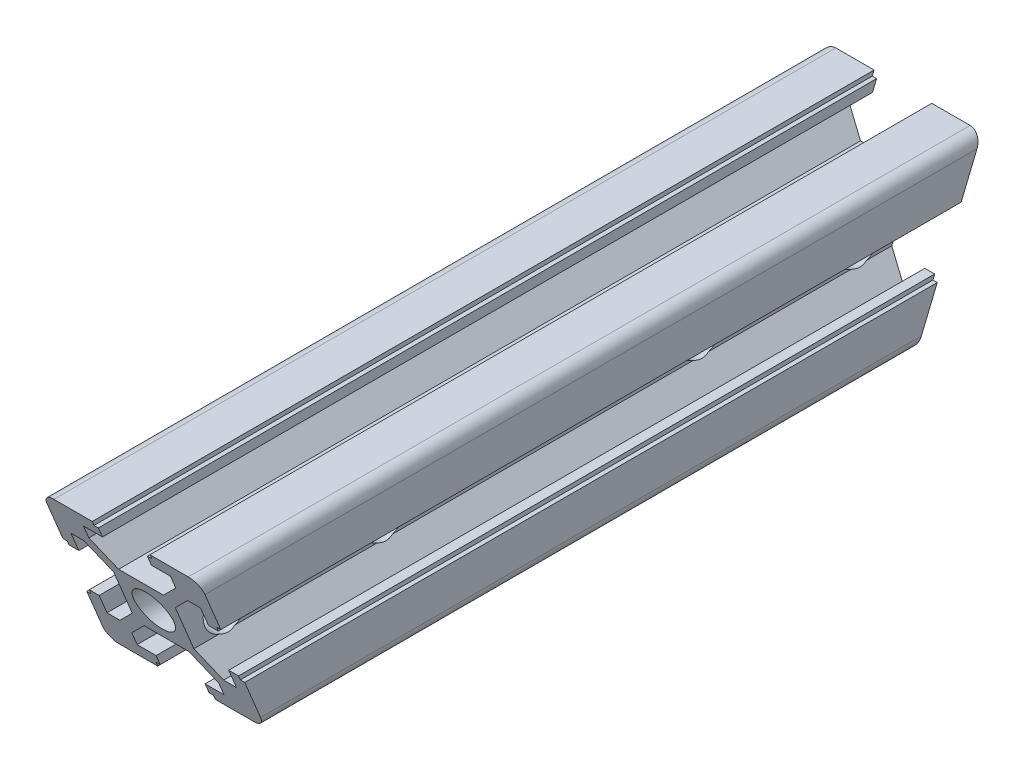
from build123d import *

# Parameters (mm, degrees)
SKETCH_2_R          = 2.55
EXTRUDE_1_DEPTH     = 98.99
SKETCH_3_R          = 3
CUT_EXTRUDE_1_DEPTH = 102.484087915
CUT_EXTRUDE_2_DEPTH = 20
SKETCH_6_R          = 3
CUT_EXTRUDE_3_DEPTH = 20


with BuildPart() as part:
    # 草图2 → 凸台-拉伸1 (new body)
    with BuildSketch(Plane.XY):
        with BuildLine():
            Line((-3.9, 2.839339828), (-6.560660172, 5.5))
            Line((-6.560660172, 5.5), (-8.2, 5.5))
            Line((-8.2, 5.5), (-8.2, 3.1))
            Line((-8.2, 3.1), (-9.45, 3.1))
            Line((-9.45, 3.1), (-9.45, 3.65))
            Line((-9.45, 3.65), (-10, 3.65))
            Line((-10, 3.65), (-10, 8.5))
            ThreePointArc((-10, 8.5), (-9.560660172, 9.560660172), (-8.5, 10))
            Line((-8.5, 10), (-3.65, 10))
            Line((-3.65, 10), (-3.65, 9.45))
            Line((-3.65, 9.45), (-3.1, 9.45))
            Line((-3.1, 9.45), (-3.1, 8.2))
            Line((-3.1, 8.2), (-5.5, 8.2))
            Line((-5.5, 8.2), (-5.5, 6.560660172))
            Line((-5.5, 6.560660172), (-2.839339828, 3.9))
            Line((-2.839339828, 3.9), (2.839339828, 3.9))
            Line((2.839339828, 3.9), (5.5, 6.560660172))
            Line((5.5, 6.560660172), (5.5, 8.2))
            Line((5.5, 8.2), (3.1, 8.2))
            Line((3.1, 8.2), (3.1, 9.45))
            Line((3.1, 9.45), (3.65, 9.45))
            Line((3.65, 9.45), (3.65, 10))
            Line((3.65, 10), (8.5, 10))
            ThreePointArc((8.5, 10), (9.560660172, 9.560660172), (10, 8.5))
            Line((10, 8.5), (10, 3.65))
            Line((10, 3.65), (9.45, 3.65))
            Line((9.45, 3.65), (9.45, 3.1))
            Line((9.45, 3.1), (8.2, 3.1))
            Line((8.2, 3.1), (8.2, 5.5))
            Line((8.2, 5.5), (6.560660172, 5.5))
            Line((6.560660172, 5.5), (3.9, 2.839339828))
            Line((3.9, 2.839339828), (3.9, -2.839339828))
            Line((3.9, -2.839339828), (6.560660172, -5.5))
            Line((6.560660172, -5.5), (8.2, -5.5))
            Line((8.2, -5.5), (8.2, -3.1))
            Line((8.2, -3.1), (9.45, -3.1))
            Line((9.45, -3.1), (9.45, -3.65))
            Line((9.45, -3.65), (10, -3.65))
            Line((10, -3.65), (10, -8.5))
            ThreePointArc((10, -8.5), (9.560660172, -9.560660172), (8.5, -10))
            Line((8.5, -10), (3.65, -10))
            Line((3.65, -10), (3.65, -9.45))
            Line((3.65, -9.45), (3.1, -9.45))
            Line((3.1, -9.45), (3.1, -8.2))
            Line((3.1, -8.2), (5.5, -8.2))
            Line((5.5, -8.2), (5.5, -6.560660172))
            Line((5.5, -6.560660172), (2.839339828, -3.9))
            Line((2.839339828, -3.9), (-2.839339828, -3.9))
            Line((-2.839339828, -3.9), (-5.5, -6.560660172))
            Line((-5.5, -6.560660172), (-5.5, -8.2))
            Line((-5.5, -8.2), (-3.1, -8.2))
            Line((-3.1, -8.2), (-3.1, -9.45))
            Line((-3.1, -9.45), (-3.65, -9.45))
            Line((-3.65, -9.45), (-3.65, -10))
            Line((-3.65, -10), (-8.5, -10))
            ThreePointArc((-8.5, -10), (-9.560660172, -9.560660172), (-10, -8.5))
            Line((-10, -8.5), (-10, -3.65))
            Line((-10, -3.65), (-9.45, -3.65))
            Line((-9.45, -3.65), (-9.45, -3.1))
            Line((-9.45, -3.1), (-8.2, -3.1))
            Line((-8.2, -3.1), (-8.2, -5.5))
            Line((-8.2, -5.5), (-6.560660172, -5.5))
            Line((-6.560660172, -5.5), (-3.9, -2.839339828))
            Line((-3.9, -2.839339828), (-3.9, 2.839339828))
        make_face()
        Circle(SKETCH_2_R, mode=Mode.SUBTRACT)
    extrude(amount=EXTRUDE_1_DEPTH)

    # 草图3 → 切除-拉伸1 (cut, through all)
    with BuildSketch(Plane(origin=(10, 0, 0), x_dir=(0, 0, -1), z_dir=(1, 0, 0))):
        with Locations(Location((-29.495, 0, 0), (0, 0, 108.835996158))):
            Circle(SKETCH_3_R)
        with Locations(Location((-69.495, 0, 0), (0, 0, 71.164003842))):
            Circle(SKETCH_3_R)
    extrude(amount=-CUT_EXTRUDE_1_DEPTH, mode=Mode.SUBTRACT)

    # 草图5 → 切除-拉伸2 (cut)
    with BuildSketch(Plane(origin=(10, 0, 0), x_dir=(0, 0, -1), z_dir=(1, 0, 0))):
        Polygon((-98.99, 10), (-90.705728753, -10), (-98.99, -10), align=None)
        Polygon((0, 10), (-8.284271247, -10), (0, -10), align=None)
    extrude(amount=-CUT_EXTRUDE_2_DEPTH, mode=Mode.SUBTRACT)

    # 草图6 → 切除-拉伸3 (cut)
    with BuildSketch(Plane(origin=(10, 0, 0), x_dir=(0, 0, -1), z_dir=(1, 0, 0))):
        with Locations(Location((-9.495, 0, 0), (0, 0, 71.164003842))):
            Circle(SKETCH_6_R)
        with Locations(Location((-89.495, 0, 0), (0, 0, 71.164003842))):
            Circle(SKETCH_6_R)
    extrude(amount=-CUT_EXTRUDE_3_DEPTH, mode=Mode.SUBTRACT)


solid = part.part
